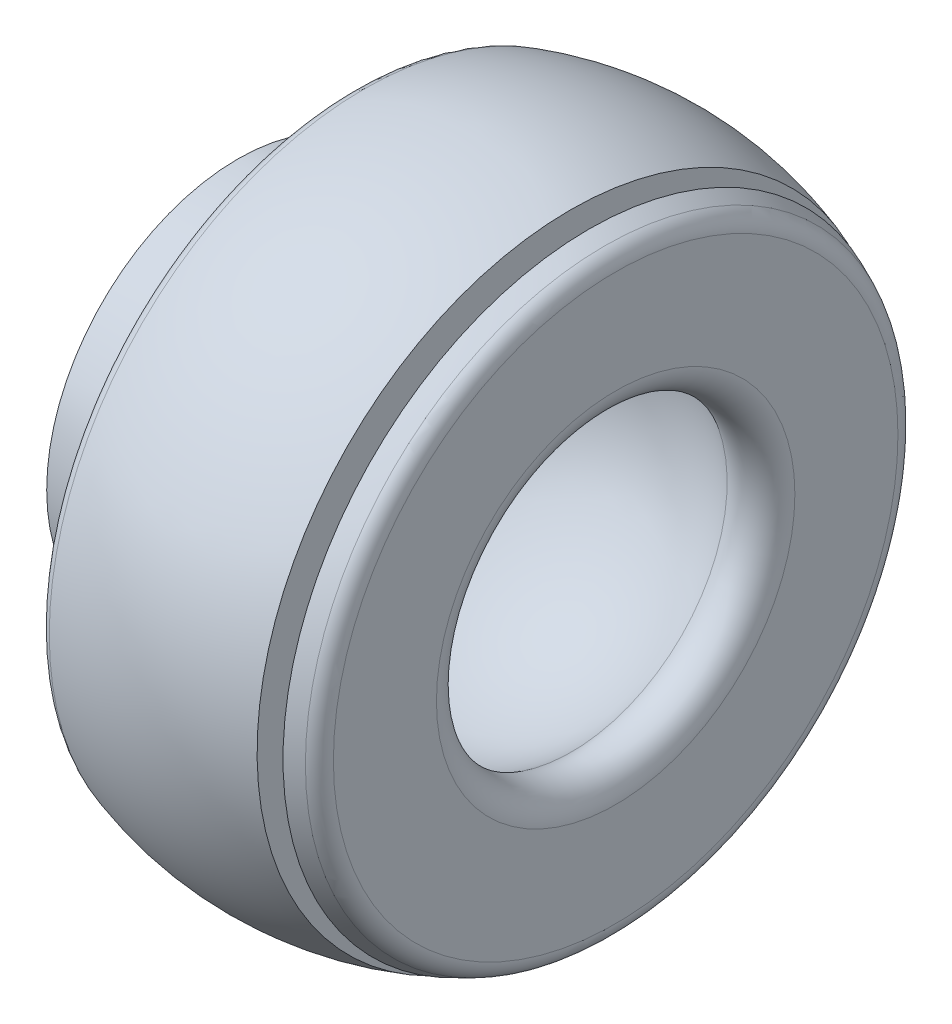
from build123d import *


with BuildPart() as part:
    # Esquisse1 → Base-Révolution (revolve)
    with BuildSketch(Plane.XY):
        with BuildLine():
            Line((-6, 5.058338536), (-6, 4.616677072))
            Line((-6, 4.616677072), (-3.417347261, 4.085789496))
            ThreePointArc((-3.417347261, 4.085789496), (-3.035514456, 4.081731073), (-2.679998482, 4.221090871))
            ThreePointArc((-2.679998482, 4.221090871), (0.087508737, 4.999234163), (2.826086957, 4.124709992))
            ThreePointArc((2.826086957, 4.124709992), (3.599689303, 4.079927688), (4, 4.74341649))
            Line((4, 4.74341649), (4, 7.470776399))
            ThreePointArc((4, 7.470776399), (3.921936373, 7.739048084), (3.712121212, 7.923550726))
            ThreePointArc((3.712121212, 7.923550726), (3.507219493, 8.016352751), (3.3, 8.103857106))
            Line((3.3, 8.103857106), (3.3, 6.113246715))
            ThreePointArc((3.3, 6.113246715), (3.05, 5.863246715), (2.8, 6.113246715))
            Line((2.8, 6.113246715), (2.8, 8.289903498))
            ThreePointArc((2.8, 8.289903498), (0.078130419, 8.749651172), (-2.651515152, 8.338583057))
            ThreePointArc((-2.651515152, 8.338583057), (-2.903582442, 8.157255623), (-3, 7.862092597))
            Line((-3, 7.862092597), (-3, 6.92649343))
            ThreePointArc((-3, 6.92649343), (-2.941421356, 6.785072074), (-2.8, 6.72649343))
            Line((-2.8, 6.72649343), (-1.942199978, 6.72649343))
            ThreePointArc((-1.942199978, 6.72649343), (-1.328953263, 6.113246715), (-1.942199978, 5.5))
            Line((-1.942199978, 5.5), (-3, 5.5))
            Line((-3, 5.5), (-6, 5.058338536))
        make_face()
    revolve(axis=Axis((-16.649534831, 0, 0), (1, 0, 0)))


solid = part.part
